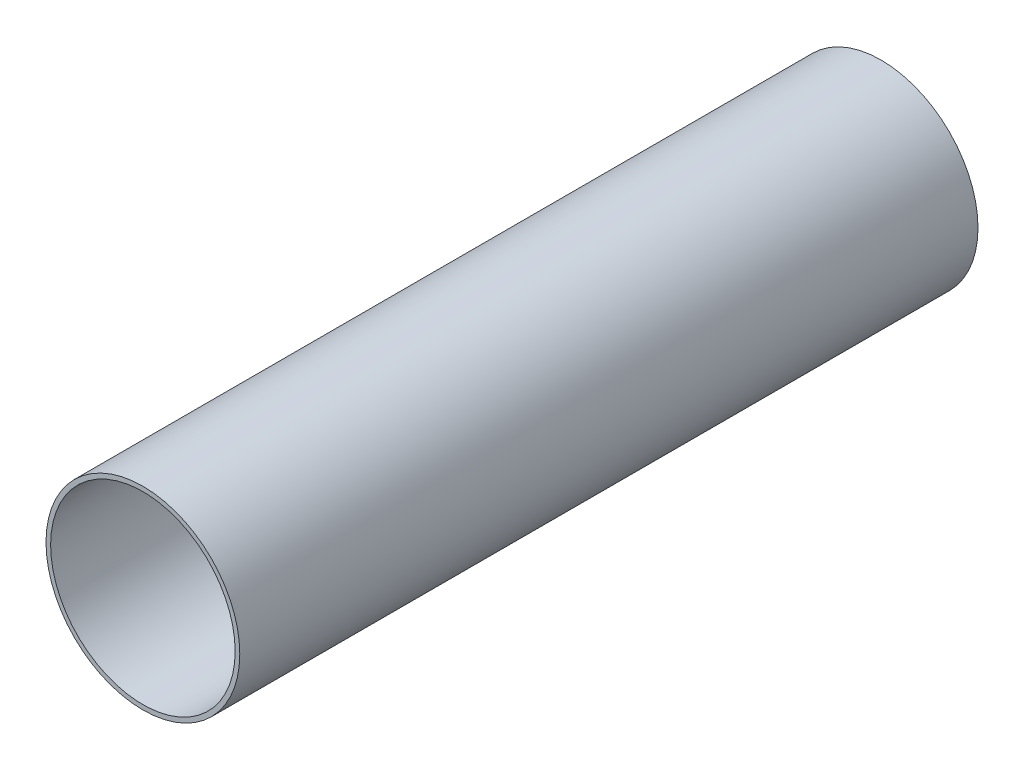
from build123d import *

# Parameters (mm, degrees)
SKETCH1_R           = 53.34
SKETCH1_R_2         = 50.8
BOSS_EXTRUDE1_DEPTH = 406.4


with BuildPart() as part:
    # Sketch1 → Boss-Extrude1 (new body)
    with BuildSketch(Plane.XY):
        Circle(SKETCH1_R)
        Circle(SKETCH1_R_2, mode=Mode.SUBTRACT)
    extrude(amount=BOSS_EXTRUDE1_DEPTH)


solid = part.part
